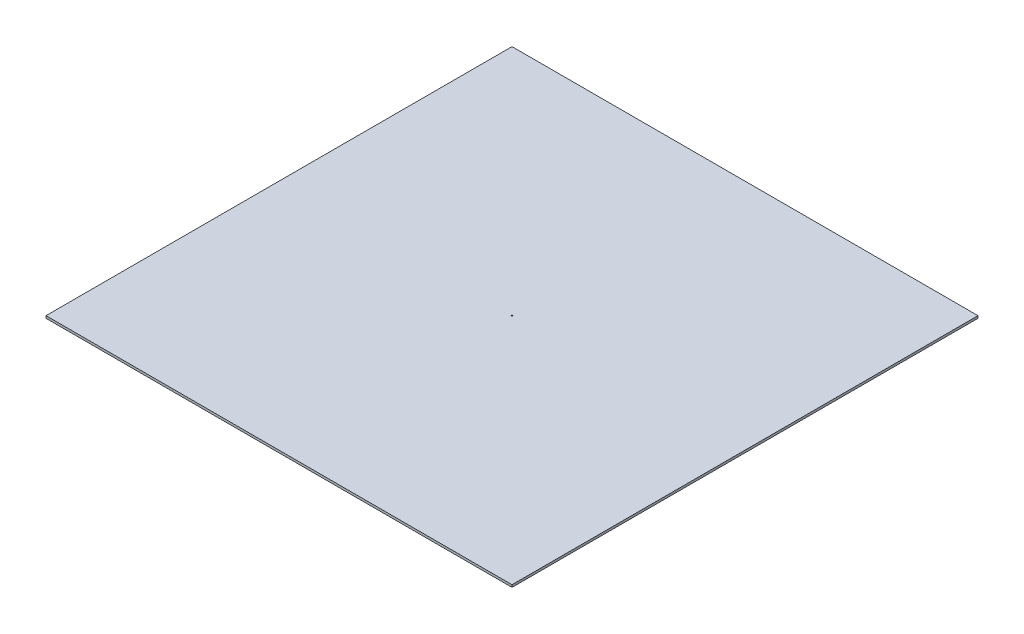
from build123d import *

# Parameters (mm, degrees)
SKETCH1_W           = 2000
SKETCH1_H           = 2000
SKETCH1_R           = 2.5
BOSS_EXTRUDE1_DEPTH = 10


with BuildPart() as part:
    # Sketch1 → Boss-Extrude1 (new body)
    with BuildSketch(Plane(origin=(0, 0, 0), x_dir=(1, 0, 0), z_dir=(0, 1, 0))):
        Rectangle(SKETCH1_W, SKETCH1_H)
        with Locations(Location((0, 0, 0), (0, 0, 270))):
            Circle(SKETCH1_R, mode=Mode.SUBTRACT)
    extrude(amount=BOSS_EXTRUDE1_DEPTH)


solid = part.part
